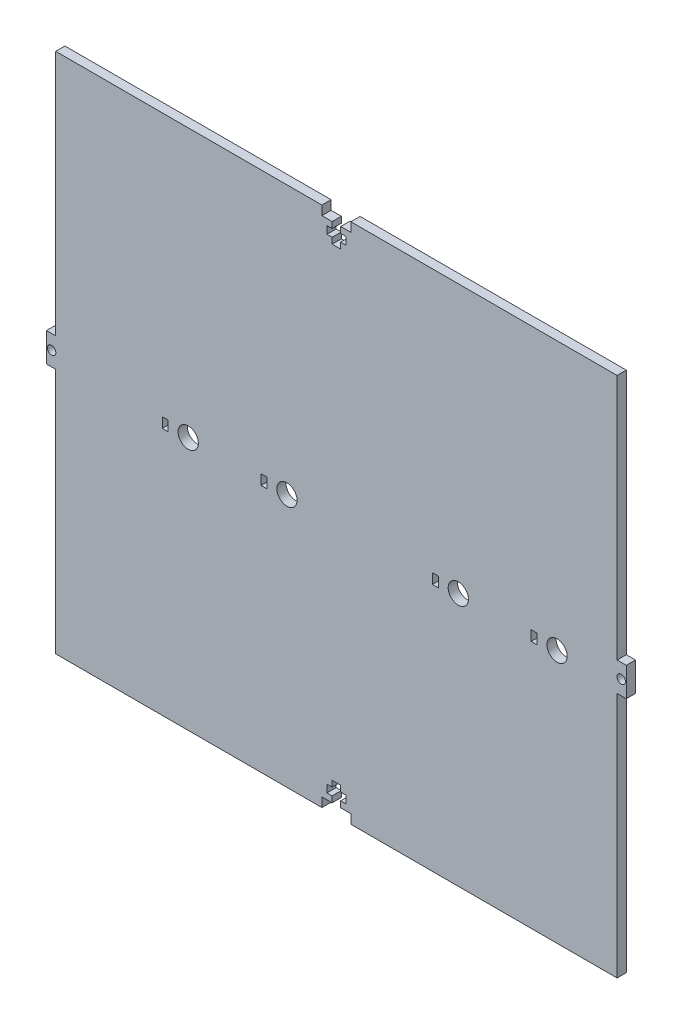
from build123d import *

# Parameters (mm, degrees)
SKETCH2_W           = 193.64
SKETCH2_H           = 180
BOSS_EXTRUDE1_DEPTH = 3.18
CUT_EXTRUDE1_DEPTH  = 133.227927459
SKETCH4_W           = 3.18
SKETCH4_H           = 10
BOSS_EXTRUDE2_DEPTH = 3.18
SKETCH6_R           = 1.47
CUT_EXTRUDE2_DEPTH  = 135.573817662
SKETCH7_R           = 3.5
CUT_EXTRUDE3_DEPTH  = 135.573817662
SKETCH9_W           = 2.024123771
SKETCH9_H           = 3.5
SKETCH9_W_2         = 2.024123772
CUT_EXTRUDE4_DEPTH  = 135.573817662


with BuildPart() as part:
    # Sketch2 → Boss-Extrude1 (new body)
    with BuildSketch(Plane.XY):
        Rectangle(SKETCH2_W, SKETCH2_H)
    extrude(amount=BOSS_EXTRUDE1_DEPTH)

    # Sketch3 → Cut-Extrude1 (cut, through all)
    with BuildSketch(Plane.XY.offset(3.18)):
        Polygon((-5, 90), (5, 90), (5, 86.82), (1.47, 86.82), (1.47, 84.74), (3.25, 84.74), (3.25, 82.14), (1.47, 82.14), (1.47, 80.07), (-1.47, 80.07), (-1.47, 82.14), (-3.25, 82.14), (-3.25, 84.74), (-1.47, 84.74), (-1.47, 86.82), (-5, 86.82), align=None)
        Polygon((1.47, -86.82), (5, -86.82), (5, -90), (-5, -90), (-5, -86.82), (-1.47, -86.82), (-1.47, -84.74), (-3.25, -84.74), (-3.25, -82.14), (-1.47, -82.14), (-1.47, -80.07), (1.47, -80.07), (1.47, -82.14), (3.25, -82.14), (3.25, -84.74), (1.47, -84.74), align=None)
    extrude(amount=-CUT_EXTRUDE1_DEPTH, mode=Mode.SUBTRACT)

    # Sketch4 → Boss-Extrude2 (add)
    with BuildSketch(Plane.ZY.offset(96.82)):
        with Locations((1.59, 0)):
            Rectangle(SKETCH4_W, SKETCH4_H)
    boss_extrude2 = extrude(amount=BOSS_EXTRUDE2_DEPTH)

    # Sketch6 → Cut-Extrude2 (cut, through all)
    with BuildSketch(Plane.XY.offset(3.18)):
        with Locations((-98.25, 0)):
            Circle(SKETCH6_R)
    cut_extrude2 = extrude(amount=-CUT_EXTRUDE2_DEPTH, mode=Mode.SUBTRACT)

    # Mirror1: Boss-Extrude2 across plane
    add(boss_extrude2.mirror(Plane(origin=(0, 0, 0), x_dir=(0, 0, 1), z_dir=(1, 0, 0))))

    # Mirror2: Cut-Extrude2 across plane
    add(cut_extrude2.mirror(Plane(origin=(0, 0, 0), x_dir=(0, 0, 1), z_dir=(1, 0, 0))), mode=Mode.SUBTRACT)

    # Sketch7 → Cut-Extrude3 (cut, through all)
    with BuildSketch(Plane.XY.offset(3.18)):
        with Locations((-51.119653384, -2.520413941)):
            Circle(SKETCH7_R)
        with Locations((-17.051323135, -2.520413941)):
            Circle(SKETCH7_R)
        with Locations((42.052504626, -2.520413941)):
            Circle(SKETCH7_R)
        with Locations((76.120834875, -2.520413941)):
            Circle(SKETCH7_R)
    extrude(amount=-CUT_EXTRUDE3_DEPTH, mode=Mode.SUBTRACT)

    # Sketch9 → Cut-Extrude4 (cut, through all)
    with BuildSketch(Plane(origin=(0, 0, 0), x_dir=(-1, 0, 0), z_dir=(0, 0, -1))):
        with Locations((59.039301131, -2.520413941)):
            Rectangle(SKETCH9_W, SKETCH9_H)
        with Locations((24.970970881, -2.520413941)):
            Rectangle(SKETCH9_W_2, SKETCH9_H)
        with Locations((-34.13285688, -2.520413941)):
            Rectangle(SKETCH9_W_2, SKETCH9_H)
        with Locations((-68.201187129, -2.520413941)):
            Rectangle(SKETCH9_W_2, SKETCH9_H)
    extrude(amount=-CUT_EXTRUDE4_DEPTH, mode=Mode.SUBTRACT)


solid = part.part
